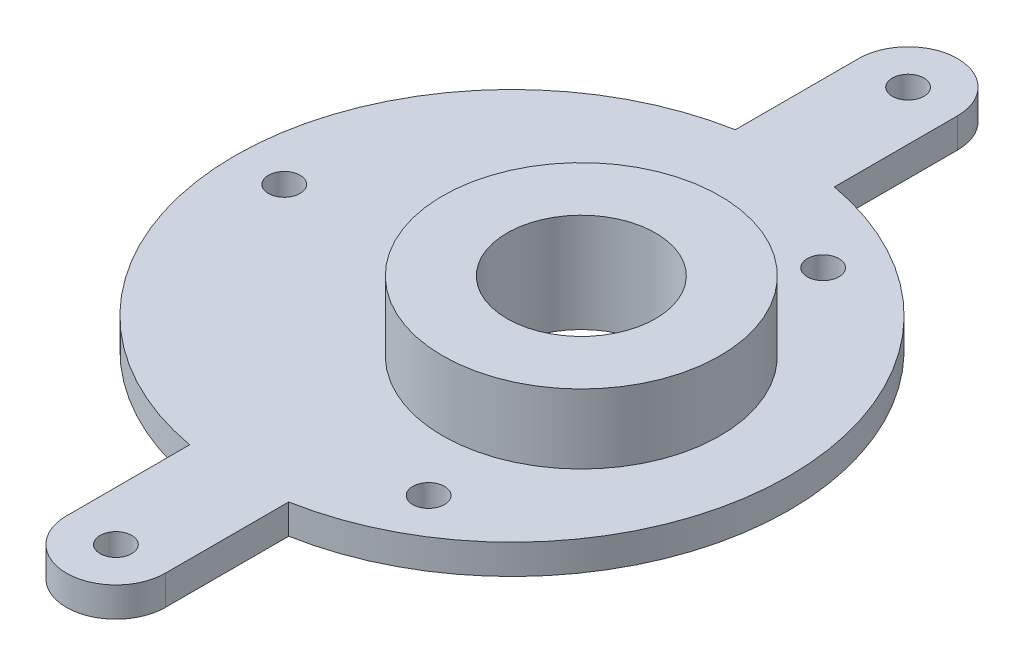
from build123d import *

# Parameters (mm, degrees)
SKETCH_1_R               = 1.6
EXTRUDE_1_DEPTH          = 3
SKETCH_4_R               = 14
EXTRUDE_2_DEPTH          = 7
CUT_EXTRUDE_1_DEPTH      = 54.460265618
CUT_EXTRUDE_1_DEPTH_BACK = 54.460265618
SKETCH_2_R               = 7.5
SKETCH_3_R               = 1.6
CUT_EXTRUDE_2_DEPTH      = 54.460265618


with BuildPart() as part:
    # ｽｹｯﾁ1 → ﾎﾞｽ - 押し出し1 (new body)
    with BuildSketch(Plane(origin=(0, 0, 0), x_dir=(1, 0, 0), z_dir=(0, 1, 0))):
        with BuildLine():
            Line((5, 40), (5, 27.549954628))
            ThreePointArc((5, 27.549954628), (28, 0), (5, -27.549954628))
            Line((5, -27.549954628), (5, -40))
            ThreePointArc((5, -40), (0, -45), (-5, -40))
            Line((-5, -40), (-5, -27.549954628))
            ThreePointArc((-5, -27.549954628), (-28, 0), (-5, 27.549954628))
            Line((-5, 27.549954628), (-5, 40))
            ThreePointArc((-5, 40), (0, 45), (5, 40))
        make_face()
        with Locations(Location((0, 40, 0), (0, 0, 270))):
            Circle(SKETCH_1_R, mode=Mode.SUBTRACT)
        with Locations(Location((0, -40, 0), (0, 0, 270))):
            Circle(SKETCH_1_R, mode=Mode.SUBTRACT)
    extrude(amount=EXTRUDE_1_DEPTH)

    # ｽｹｯﾁ4 → ﾎﾞｽ - 押し出し2 (add)
    with BuildSketch(Plane(origin=(0, 3, 0), x_dir=(1, 0, 0), z_dir=(0, 1, 0))):
        with Locations(Location((7, 0, 0), (0, 0, 270))):
            Circle(SKETCH_4_R)
    extrude(amount=EXTRUDE_2_DEPTH)

    # ｽｹｯﾁ2 → ｶｯﾄ - 押し出し1 (cut, two sides: drawn at the far end of the back side and taken through both)
    with BuildSketch(Plane(origin=(0, 3, 0), x_dir=(1, 0, 0), z_dir=(0, 1, 0)).offset(-CUT_EXTRUDE_1_DEPTH_BACK)):
        with Locations(Location((7, 0, 0), (0, 0, 270))):
            Circle(SKETCH_2_R)
    extrude(amount=CUT_EXTRUDE_1_DEPTH + CUT_EXTRUDE_1_DEPTH_BACK, mode=Mode.SUBTRACT)

    # ｽｹｯﾁ3 → ｶｯﾄ - 押し出し2 (cut, through all)
    with BuildSketch(Plane(origin=(0, 3, 0), x_dir=(1, 0, 0), z_dir=(0, 1, 0))):
        with Locations(Location((-23, 0, 0), (0, 0, 270))):
            Circle(SKETCH_3_R)
        with Locations(Location((11.5, 19.918584287, 0), (0, 0, 270))):
            Circle(SKETCH_3_R)
        with Locations(Location((11.5, -19.918584287, 0), (0, 0, 270))):
            Circle(SKETCH_3_R)
    extrude(amount=-CUT_EXTRUDE_2_DEPTH, mode=Mode.SUBTRACT)


solid = part.part
